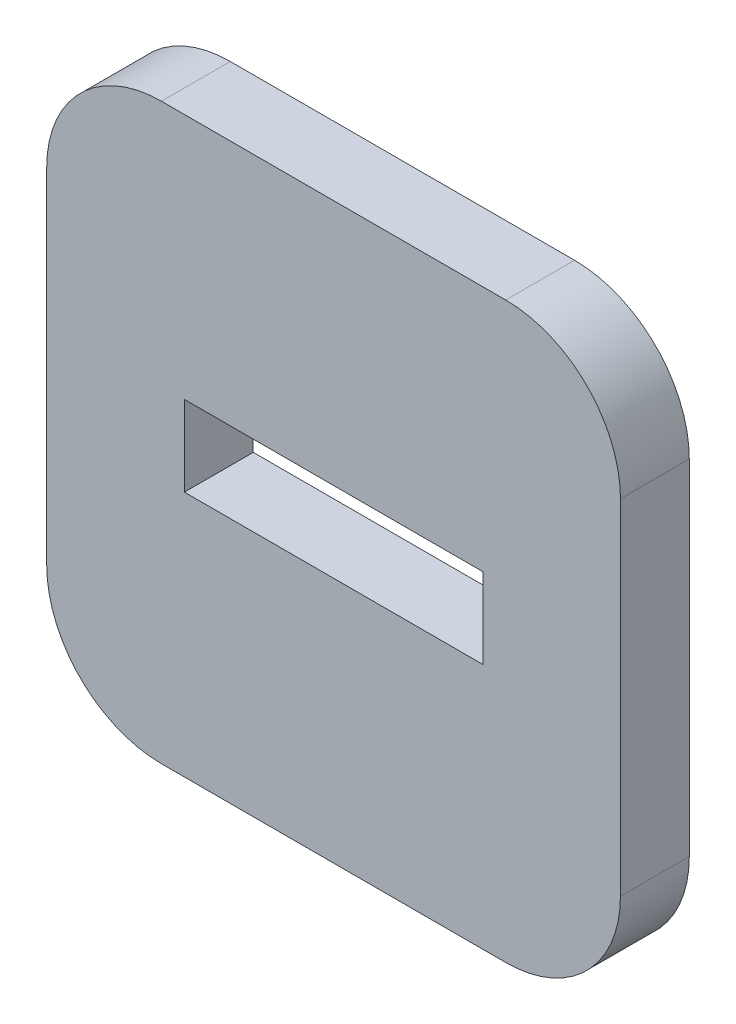
from build123d import *

# Parameters (mm, degrees)
SKETCH1_W           = 25.4
SKETCH1_H           = 25.4
SKETCH1_W_2         = 13.208
SKETCH1_H_2         = 3.556
BOSS_EXTRUDE1_DEPTH = 3.048
FILLET1_R           = 5.08


with BuildPart() as part:
    # Sketch1 → Boss-Extrude1 (new body)
    with BuildSketch(Plane.XY):
        with Locations((-118.408892295, 0)):
            Rectangle(SKETCH1_W, SKETCH1_H)
        with Locations((-118.408892295, 0)):
            Rectangle(SKETCH1_W_2, SKETCH1_H_2, mode=Mode.SUBTRACT)
    extrude(amount=-BOSS_EXTRUDE1_DEPTH)

    # Fillet1
    fillet1_edges = [part.edges().sort_by_distance(p)[0] for p in [
        (-131.108892295, -12.7, -1.524),
        (-105.708892295, -12.7, -1.524),
        (-105.708892295, 12.7, -1.524),
        (-131.108892295, 12.7, -1.524),
    ]]
    fillet(fillet1_edges, radius=FILLET1_R)


solid = part.part
